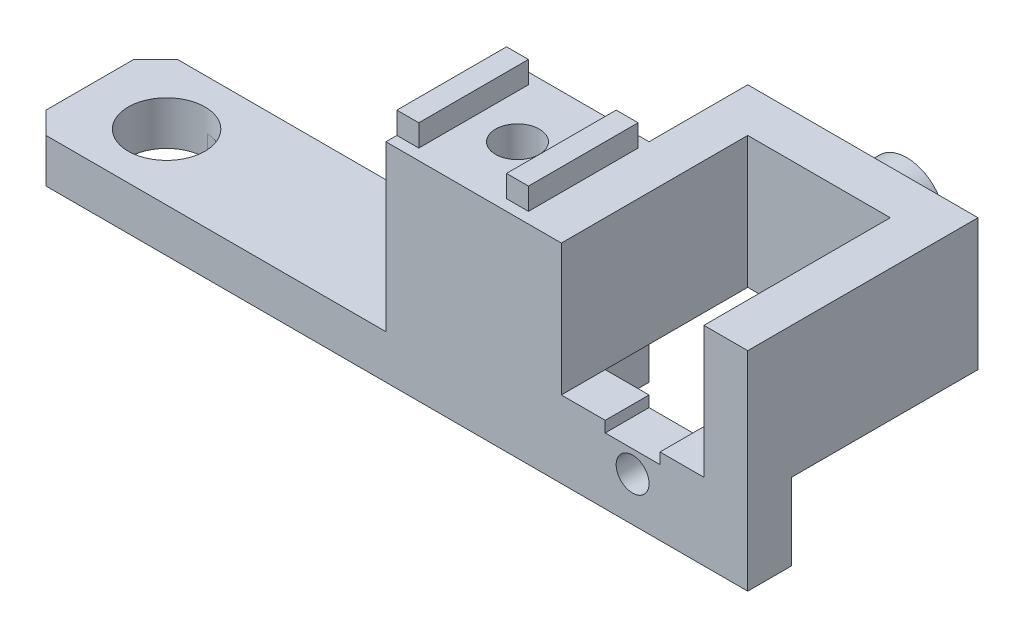
from build123d import *

# Parameters (mm, degrees)
SKETCH_1_W               = 45
SKETCH_1_H               = 12
EXTRUDE_1_DEPTH          = 4
SKETCH_2_W               = 12
SKETCH_2_H               = 12
EXTRUDE_2_DEPTH          = 15
SKETCH_3_W               = 2
SKETCH_3_H               = 10
EXTRUDE_3_DEPTH          = 2
SKETCH_4_W               = 21
SKETCH_4_H               = 21
EXTRUDE_4_DEPTH          = 19
SKETCH_5_W               = 13
SKETCH_5_H               = 13
CUT_EXTRUDE_1_DEPTH      = 50.782024868
SKETCH_6_W               = 13
SKETCH_6_H               = 4
CUT_EXTRUDE_2_DEPTH      = 12
CUT_EXTRUDE_3_REACH      = 54.671
SKETCH_7_W               = 5
SKETCH_7_H               = 2
CUT_EXTRUDE_4_REACH      = 54.671
SKETCH_8_R               = 1.5
CHAMFER_1_SIZE           = 2
CUT_EXTRUDE_5_DEPTH      = 50.053542176
CUT_EXTRUDE_5_DEPTH_BACK = 50.053542176
SKETCH_9_R               = 3.5
CUT_EXTRUDE_6_DEPTH      = 51.5791459
CUT_EXTRUDE_6_DEPTH_BACK = 2
SKETCH_10_R              = 2
CUT_EXTRUDE_7_DEPTH      = 50.782024868
CUT_EXTRUDE_7_DEPTH_BACK = 50.782024868
SKETCH_11_R              = 2
CUT_EXTRUDE_8_DEPTH      = 51.5791459
CUT_EXTRUDE_8_DEPTH_BACK = 10
SKETCH_12_R              = 3.5
SKETCH_13_W              = 21
SKETCH_13_H              = 7
CUT_EXTRUDE_9_DEPTH      = 17
SKETCH_14_R              = 3.5
EXTRUDE_5_DEPTH          = 4


with BuildPart() as part:
    # 草图1 → 凸台-拉伸1 (new body)
    with BuildSketch(Plane(origin=(0, 0, 0), x_dir=(1, 0, 0), z_dir=(0, 1, 0))):
        Rectangle(SKETCH_1_W, SKETCH_1_H)
    extrude(amount=EXTRUDE_1_DEPTH)

    # 草图2 → 凸台-拉伸2 (add)
    with BuildSketch(Plane(origin=(0, 4, 0), x_dir=(1, 0, 0), z_dir=(0, 1, 0))):
        with Locations((16.5, 0)):
            Rectangle(SKETCH_2_W, SKETCH_2_H)
    extrude(amount=EXTRUDE_2_DEPTH)

    # 草图3 → 凸台-拉伸3 (add)
    with BuildSketch(Plane(origin=(0, 19, 0), x_dir=(1, 0, 0), z_dir=(0, 1, 0))):
        with Locations((11.5, 0)):
            Rectangle(SKETCH_3_W, SKETCH_3_H)
        with Locations((21.5, 0)):
            Rectangle(SKETCH_3_W, SKETCH_3_H)
    extrude(amount=EXTRUDE_3_DEPTH)

    # 草图4 → 凸台-拉伸4 (add)
    with BuildSketch(Plane.XZ):
        with Locations((33, -4.5)):
            Rectangle(SKETCH_4_W, SKETCH_4_H)
    extrude(amount=-EXTRUDE_4_DEPTH)

    # 草图5 → 切除-拉伸1 (cut, through all)
    with BuildSketch(Plane(origin=(0, 19, 0), x_dir=(1, 0, 0), z_dir=(0, 1, 0))):
        with Locations((33, 4.5)):
            Rectangle(SKETCH_5_W, SKETCH_5_H)
    extrude(amount=-CUT_EXTRUDE_1_DEPTH, mode=Mode.SUBTRACT)

    # 草图6 → 切除-拉伸2 (cut)
    with BuildSketch(Plane(origin=(0, 19, 0), x_dir=(1, 0, 0), z_dir=(0, 1, 0))):
        with Locations((33, -4)):
            Rectangle(SKETCH_6_W, SKETCH_6_H)
    extrude(amount=-CUT_EXTRUDE_2_DEPTH, mode=Mode.SUBTRACT)

    # 草图7 → 切除-拉伸3 (cut, up to next)
    with BuildSketch(Plane.XY.offset(6), mode=Mode.PRIVATE) as cut_extrude_3_sk1:
        with Locations((33, 7)):
            Rectangle(SKETCH_7_W, SKETCH_7_H)
    cut_extrude_3_tool1 = extrude(cut_extrude_3_sk1.sketch, amount=-CUT_EXTRUDE_3_REACH, mode=Mode.PRIVATE) & part.part
    add(cut_extrude_3_tool1.solids().sort_by_distance((33, 7, 6))[0], mode=Mode.SUBTRACT)

    # 草图8 → 切除-拉伸4 (cut, up to next)
    with BuildSketch(Plane.XY.offset(6), mode=Mode.PRIVATE) as cut_extrude_4_sk1:
        with Locations((33, 4)):
            Circle(SKETCH_8_R)
    cut_extrude_4_tool1 = extrude(cut_extrude_4_sk1.sketch, amount=-CUT_EXTRUDE_4_REACH, mode=Mode.PRIVATE) & part.part
    add(cut_extrude_4_tool1.solids().sort_by_distance((33, 4, 6))[0], mode=Mode.SUBTRACT)

    # 倒角1
    chamfer_1_edges = [part.edges().sort_by_distance(p)[0] for p in [
        (-22.5, 2, -6),
        (-22.5, 2, 6),
    ]]
    chamfer(chamfer_1_edges, length=CHAMFER_1_SIZE)

    # 草图9 → 切除-拉伸5 (cut, two sides: drawn at the far end of the back side and taken through both)
    with BuildSketch(Plane(origin=(0, 4, 0), x_dir=(1, 0, 0), z_dir=(0, 1, 0)).offset(-CUT_EXTRUDE_5_DEPTH_BACK)):
        with Locations(Location((-15.5, 0, 0), (0, 0, 270))):
            Circle(SKETCH_9_R)
    extrude(amount=CUT_EXTRUDE_5_DEPTH + CUT_EXTRUDE_5_DEPTH_BACK, mode=Mode.SUBTRACT)

    # 草图10 → 切除-拉伸6 (cut, two sides: drawn at the far end of the back side and taken through both)
    with BuildSketch(Plane.XZ.offset(-CUT_EXTRUDE_6_DEPTH_BACK)):
        with BuildLine():
            Line((8.625, 1.996089928), (-15.28125, 3.493157374))
            ThreePointArc((-15.28125, 3.493157374), (-12.948958546, 2.396286189), (-12, 0))
            ThreePointArc((-12, 0), (-12.948958546, -2.396286189), (-15.28125, -3.493157374))
            Line((-15.28125, -3.493157374), (8.625, -1.996089928))
            ThreePointArc((8.625, -1.996089928), (6.5, 0), (8.625, 1.996089928))
        make_face()
        with Locations((8.5, 0)):
            Circle(SKETCH_10_R)
    extrude(amount=CUT_EXTRUDE_6_DEPTH + CUT_EXTRUDE_6_DEPTH_BACK, mode=Mode.SUBTRACT)

    # 草图11 → 切除-拉伸7 (cut, two sides: drawn at the far end of the back side and taken through both)
    with BuildSketch(Plane(origin=(0, 19, 0), x_dir=(1, 0, 0), z_dir=(0, 1, 0)).offset(-CUT_EXTRUDE_7_DEPTH_BACK)):
        with Locations(Location((16.5, 0, 0), (0, 0, 270))):
            Circle(SKETCH_11_R)
    extrude(amount=CUT_EXTRUDE_7_DEPTH + CUT_EXTRUDE_7_DEPTH_BACK, mode=Mode.SUBTRACT)

    # 草图12 → 切除-拉伸8 (cut, two sides: drawn at the far end of the back side and taken through both)
    with BuildSketch(Plane.XZ.offset(-CUT_EXTRUDE_8_DEPTH_BACK)):
        with Locations(Location((16.5, 0, 0), (0, 0, 90))):
            Circle(SKETCH_12_R)
    extrude(amount=CUT_EXTRUDE_8_DEPTH + CUT_EXTRUDE_8_DEPTH_BACK, mode=Mode.SUBTRACT)

    # 草图13 → 切除-拉伸9 (cut)
    with BuildSketch(Plane(origin=(0, 0, -15), x_dir=(-1, 0, 0), z_dir=(0, 0, -1))):
        with Locations((-33, 3.5)):
            Rectangle(SKETCH_13_W, SKETCH_13_H)
    extrude(amount=-CUT_EXTRUDE_9_DEPTH, mode=Mode.SUBTRACT)

    # 草图14 → 凸台-拉伸5 (add)
    with BuildSketch(Plane(origin=(0, 0, -15), x_dir=(-1, 0, 0), z_dir=(0, 0, -1))):
        with Locations((-33, 13)):
            Circle(SKETCH_14_R)
    extrude(amount=EXTRUDE_5_DEPTH)


solid = part.part
